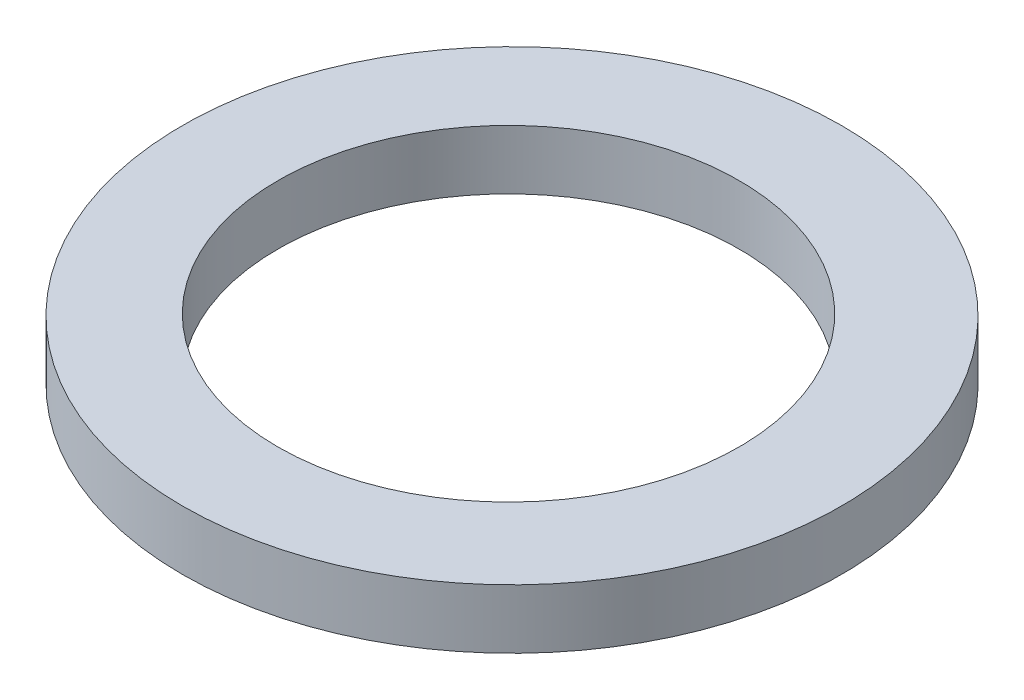
from build123d import *

# Parameters (mm, degrees)
SKETCH1_R           = 25.4
SKETCH1_R_2         = 17.78
BOSS_EXTRUDE1_DEPTH = 4.572


with BuildPart() as part:
    # Sketch1 → Boss-Extrude1 (new body)
    with BuildSketch(Plane(origin=(0, 0, 0), x_dir=(1, 0, 0), z_dir=(0, 1, 0))):
        with Locations(Location((0.268183518, 0, 0), (0, 0, 270))):
            Circle(SKETCH1_R)
        with Locations(Location((0, 0, 0), (0, 0, 270))):
            Circle(SKETCH1_R_2, mode=Mode.SUBTRACT)
    extrude(amount=BOSS_EXTRUDE1_DEPTH)


solid = part.part
